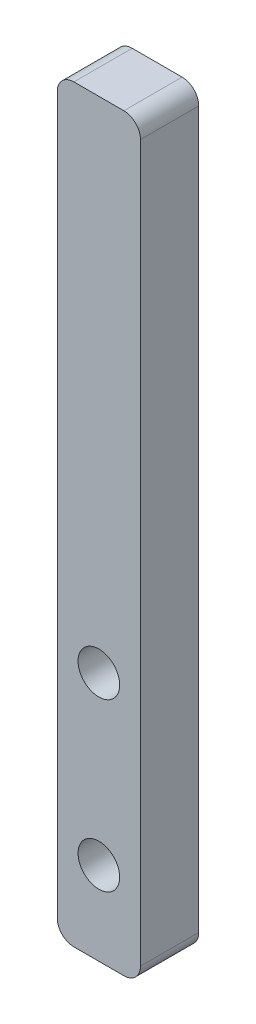
from build123d import *

# Parameters (mm, degrees)
CROQUIS1_W              = 10
CROQUIS1_H              = 90
SALIENTE_EXTRUIR1_DEPTH = 7
CROQUIS2_R              = 2.5
CORTAR_EXTRUIR1_DEPTH   = 46.814844756
REDONDEO1_R             = 2


with BuildPart() as part:
    # Croquis1 → Saliente-Extruir1 (new body)
    with BuildSketch(Plane.XY):
        Rectangle(CROQUIS1_W, CROQUIS1_H)
    extrude(amount=SALIENTE_EXTRUIR1_DEPTH)

    # Croquis2 → Cortar-Extruir1 (cut, through all)
    with BuildSketch(Plane.XY.offset(7)):
        with Locations((0, -35)):
            Circle(CROQUIS2_R)
        with Locations((0, -15)):
            Circle(CROQUIS2_R)
    extrude(amount=-CORTAR_EXTRUIR1_DEPTH, mode=Mode.SUBTRACT)

    # Redondeo1
    redondeo1_edges = [part.edges().sort_by_distance(p)[0] for p in [
        (-5, 45, 3.5),
        (5, 45, 3.5),
        (5, -45, 3.5),
        (-5, -45, 3.5),
    ]]
    fillet(redondeo1_edges, radius=REDONDEO1_R)


solid = part.part
